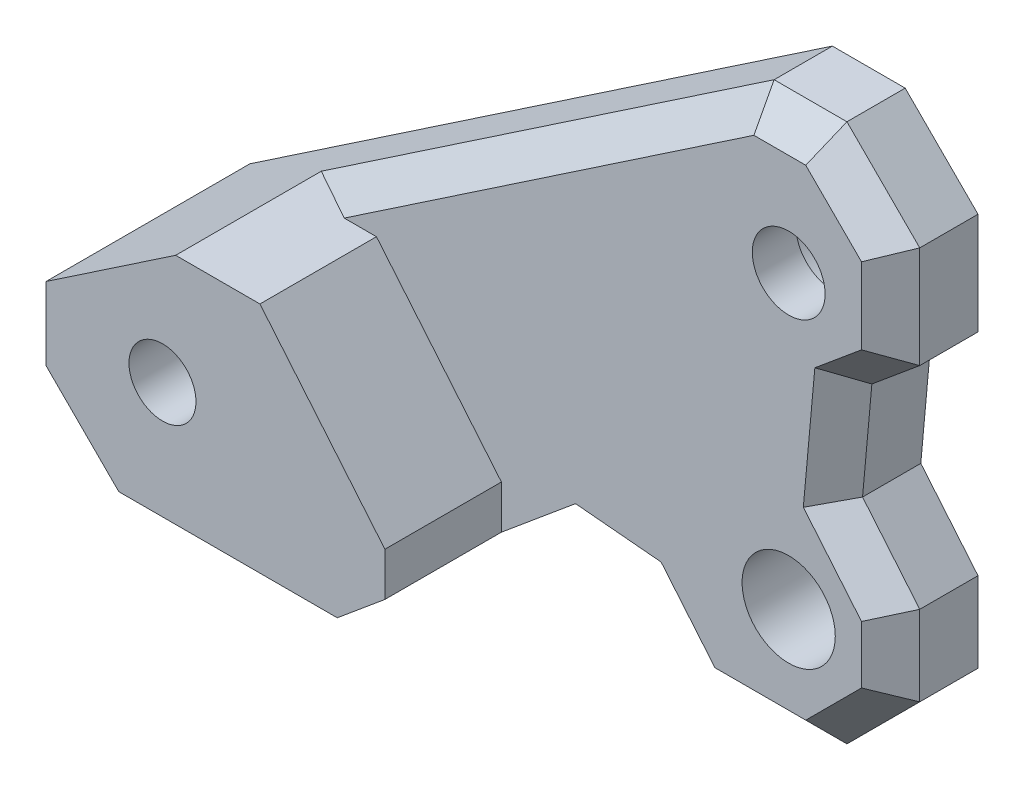
from build123d import *

# Parameters (mm, degrees)
SKETCH_1_R          = 2.3
SKETCH_1_R_2        = 3.2
SKETCH_1_R_3        = 2.5
EXTRUDE_1_DEPTH     = 6
CHAMFER_1_SIZE      = 5
EXTRUDE_2_DEPTH     = 8
SKETCH_4_R          = 2.3
CUT_EXTRUDE_1_DEPTH = 8
CHAMFER_3_SIZE      = 2
SKETCH_5_R          = 4.05
CUT_EXTRUDE_2_DEPTH = 3
FILLET_1_R          = 0.5


with BuildPart() as part:
    # 草图1 → 凸台-拉伸1 (new body)
    with BuildSketch(Plane.XY):
        Polygon((21.045855827, 22.973933312), (-18.954144173, -4.026066688), (-18.954144173, -14.026066688), (1.045855827, -14.026066688), (11.078642712, -5.66541095), (18.045855827, -14.026066688), (31.045855827, -14.026066688), (31.045855827, -3.521043084), (23.917178911, 5.033369215), (31.045855827, 10.973933312), (31.045855827, 22.973933312), align=None)
        with Locations((-10.954144173, -6.026066688)):
            Circle(SKETCH_1_R, mode=Mode.SUBTRACT)
        with Locations((24.045855827, -6.026066688)):
            Circle(SKETCH_1_R_2, mode=Mode.SUBTRACT)
        with Locations((24.045855827, 13.973933312)):
            Circle(SKETCH_1_R_3, mode=Mode.SUBTRACT)
    extrude(amount=EXTRUDE_1_DEPTH)

    # 倒角1
    chamfer_1_edges = [part.edges().sort_by_distance(p)[0] for p in [
        (23.917178911, 5.033369215, 3),
        (31.045855827, -14.026066688, 3),
        (11.078642712, -5.66541095, 3),
        (-18.954144173, -14.026066688, 3),
        (31.045855827, 22.973933312, 3),
    ]]
    chamfer(chamfer_1_edges, length=CHAMFER_1_SIZE)

    # 草图3 → 凸台-拉伸2 (add)
    with BuildSketch(Plane.XY.offset(6)):
        Polygon((-10.05036615, 1.983983477), (-4.262738325, 1.983983477), (4.318113554, -8.313038778), (4.318113554, -11.299185249), (1.045855827, -14.026066688), (-13.954144173, -14.026066688), (-18.954144173, -9.026066688), (-18.954144173, -4.026066688), align=None)
    extrude(amount=EXTRUDE_2_DEPTH)

    # 草图4 → 切除-拉伸1 (cut)
    with BuildSketch(Plane(origin=(0, 0, 6), x_dir=(-1, 0, 0), z_dir=(0, 0, -1))):
        with Locations((10.954144173, -6.026066688)):
            Circle(SKETCH_4_R)
    extrude(amount=-CUT_EXTRUDE_1_DEPTH, mode=Mode.SUBTRACT)

    # 倒角3
    chamfer_3_edges = [part.edges().sort_by_distance(p)[0] for p in [
        (10.758550512, -9.186425149, 6),
        (16.162710269, -11.766292018, 6),
        (22.045855827, -14.026066688, 6),
        (28.545855827, -11.526066688, 6),
        (31.045855827, -6.273554886, 6),
        (29.081978368, -1.164390133, 6),
        (27.438193109, 4.713277016, 6),
        (5.497744838, 12.478958395, 6),
        (23.545855827, 22.973933312, 6),
        (28.545855827, 20.473933312, 6),
        (31.045855827, 14.473933312, 6),
        (29.402070568, 9.604112263, 6),
    ]]
    chamfer(chamfer_3_edges, length=CHAMFER_3_SIZE)

    # 草图5 → 切除-拉伸2 (cut)
    with BuildSketch(Plane(origin=(0, 0, 0), x_dir=(-1, 0, 0), z_dir=(0, 0, -1))):
        with Locations((-24.045855827, 13.973933312)):
            Circle(SKETCH_5_R)
    extrude(amount=-CUT_EXTRUDE_2_DEPTH, mode=Mode.SUBTRACT)

    # 圆角1
    fillet_1_edges = [part.edges().sort_by_distance(p)[0] for p in [
        (28.095855827, 13.973933312, 0),
    ]]
    fillet(fillet_1_edges, radius=FILLET_1_R)


solid = part.part
